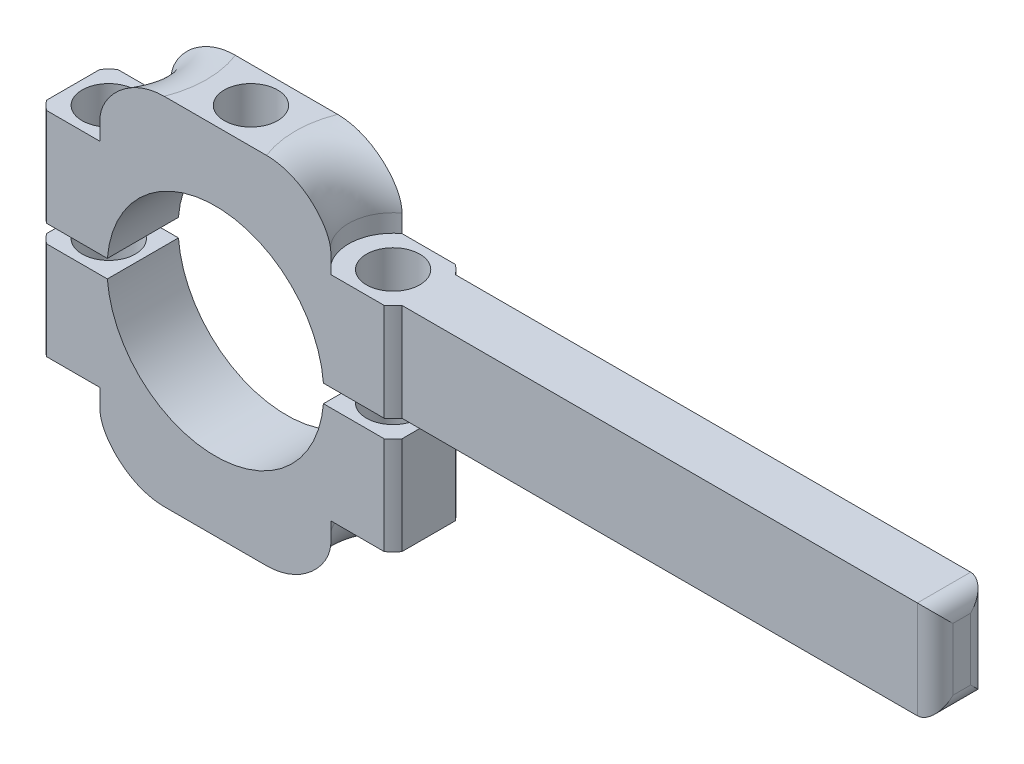
from build123d import *

# Parameters (mm, degrees)
BOSS_EXTRUDE1_DEPTH   = 4
BOSS_EXTRUDE1_2_DEPTH = 4
CUT_EXTRUDE1_START    = -10
SKETCH2_R             = 2.5
SKETCH2_R_2           = 1.5
CUT_EXTRUDE1_DEPTH    = 4
CUT_EXTRUDE2_START    = 6
SKETCH3_R             = 2.5
SKETCH3_R_2           = 1.5
CUT_EXTRUDE2_DEPTH    = 4
SKETCH4_R             = 1.5
CUT_EXTRUDE3_DEPTH    = 23.715633383
SKETCH5_R             = 1.5
CUT_EXTRUDE4_DEPTH    = 6
FILLET1_R             = 3
FILLET2_R             = 3
SKETCH6_W             = 3
SKETCH6_H             = 5.5
BOSS_EXTRUDE2_DEPTH   = 30
FILLET3_R             = 1


with BuildPart() as part:
    # Sketch1 → Boss-Extrude1 (new body)
    with BuildSketch(Plane.XY):
        with BuildLine():
            Line((-10, -0.5), (-10, -10))
            Line((-10, -10), (10, -10))
            Line((10, -10), (10, -0.5))
            Line((10, -0.5), (6.079473661, -0.5))
            ThreePointArc((6.079473661, -0.5), (0, -6.1), (-6.079473661, -0.5))
            Line((-6.079473661, -0.5), (-10, -0.5))
        make_face()
    extrude(amount=BOSS_EXTRUDE1_DEPTH)

    # Sketch2 → Cut-Extrude1 (cut)
    # profile 1 of 2: a face of its own
    with BuildSketch(Plane(origin=(0, 0, 0), x_dir=(1, 0, 0), z_dir=(0, 1, 0)).offset(CUT_EXTRUDE1_START)):
        with Locations((8, -2)):
            Circle(SKETCH2_R)
    # profile 2 of 2: a face of its own
    with BuildSketch(Plane(origin=(0, 0, 0), x_dir=(1, 0, 0), z_dir=(0, 1, 0)).offset(CUT_EXTRUDE1_START)):
        with Locations((-8, -2)):
            Circle(SKETCH2_R)
        with Locations(Location((-8, -2, 0), (0, 0, 270))):
            Circle(SKETCH2_R_2, mode=Mode.SUBTRACT)
    extrude(amount=CUT_EXTRUDE1_DEPTH, mode=Mode.SUBTRACT)


with BuildPart() as body_2:
    # Sketch1 → Boss-Extrude1 2 (new body)
    with BuildSketch(Plane.XY):
        with BuildLine():
            Line((-10, 10), (-10, 0.5))
            Line((-10, 0.5), (-6.079473661, 0.5))
            ThreePointArc((-6.079473661, 0.5), (0, 6.1), (6.079473661, 0.5))
            Line((6.079473661, 0.5), (10, 0.5))
            Line((10, 0.5), (10, 10))
            Line((10, 10), (-10, 10))
        make_face()
    extrude(amount=BOSS_EXTRUDE1_2_DEPTH)

    # Sketch3 → Cut-Extrude2 (cut)
    # profile 1 of 2: a face of its own
    with BuildSketch(Plane(origin=(0, 0, 0), x_dir=(1, 0, 0), z_dir=(0, 1, 0)).offset(CUT_EXTRUDE2_START)):
        with Locations((-8, -2)):
            Circle(SKETCH3_R)
        with Locations(Location((-8, -2, 0), (0, 0, 270))):
            Circle(SKETCH3_R_2, mode=Mode.SUBTRACT)
    # profile 2 of 2: a face of its own
    with BuildSketch(Plane(origin=(0, 0, 0), x_dir=(1, 0, 0), z_dir=(0, 1, 0)).offset(CUT_EXTRUDE2_START)):
        with Locations((8, -2)):
            Circle(SKETCH3_R)
        with Locations(Location((8, -2, 0), (0, 0, 270))):
            Circle(SKETCH3_R_2, mode=Mode.SUBTRACT)
    extrude(amount=CUT_EXTRUDE2_DEPTH, mode=Mode.SUBTRACT)


with BuildPart() as cut_extrude3_tool:
    # Sketch4 → Cut-Extrude3 (new, through all)
    with BuildSketch(Plane(origin=(0, 10, 0), x_dir=(1, 0, 0), z_dir=(0, 1, 0))):
        with Locations(Location((8, -2, 0), (0, 0, 270))):
            Circle(SKETCH4_R)
        with Locations(Location((-8, -2, 0), (0, 0, 270))):
            Circle(SKETCH4_R)
        with BuildLine():
            Line((-10, -3.5), (-10, -4))
            Line((-10, -4), (-9.5, -4))
            ThreePointArc((-9.5, -4), (-9.767766953, -3.767766953), (-10, -3.5))
        make_face()
        with BuildLine():
            Line((-9.5, 0), (-10, 0))
            Line((-10, 0), (-10, -0.5))
            ThreePointArc((-10, -0.5), (-9.767766953, -0.232233047), (-9.5, 0))
        make_face()
        with BuildLine():
            Line((10, -0.5), (10, 0))
            Line((10, 0), (9.5, 0))
            ThreePointArc((9.5, 0), (9.767766953, -0.232233047), (10, -0.5))
        make_face()
        with BuildLine():
            Line((9.5, -4), (10, -4))
            Line((10, -4), (10, -3.5))
            ThreePointArc((10, -3.5), (9.767766953, -3.767766953), (9.5, -4))
        make_face()
    extrude(amount=-CUT_EXTRUDE3_DEPTH)


with BuildPart() as part_1:
    add(part.part)

    # Cut-Extrude3: cut by cut_extrude3_tool
    add(cut_extrude3_tool.part, mode=Mode.SUBTRACT)

    # Fillet2
    fillet2_edges = [part_1.edges().sort_by_distance(p)[0] for p in [
        (-5.5, -10, 2),
        (5.5, -10, 2),
    ]]
    fillet(fillet2_edges, radius=FILLET2_R)


with BuildPart() as body_2_1:
    add(body_2.part)

    # Cut-Extrude3: cut by cut_extrude3_tool
    add(cut_extrude3_tool.part, mode=Mode.SUBTRACT)

    # Sketch5 → Cut-Extrude4 (cut)
    with BuildSketch(Plane(origin=(0, 10, 0), x_dir=(1, 0, 0), z_dir=(0, 1, 0))):
        with Locations(Location((0, -2, 0), (0, 0, 270))):
            Circle(SKETCH5_R)
    extrude(amount=-CUT_EXTRUDE4_DEPTH, mode=Mode.SUBTRACT)

    # Fillet1
    fillet1_edges = [body_2_1.edges().sort_by_distance(p)[0] for p in [
        (-5.5, 10, 2),
        (5.5, 10, 2),
    ]]
    fillet(fillet1_edges, radius=FILLET1_R)

    # Sketch6 → Boss-Extrude2 (add)
    with BuildSketch(Plane(origin=(10, 0, 0), x_dir=(0, 0, -1), z_dir=(1, 0, 0))):
        with Locations((-2, 3.25)):
            Rectangle(SKETCH6_W, SKETCH6_H)
    extrude(amount=BOSS_EXTRUDE2_DEPTH)

    # Fillet3
    fillet3_edges = [body_2_1.edges().sort_by_distance(p)[0] for p in [
        (40, 3.25, 3.5),
        (40, 0.5, 2),
        (40, 3.25, 0.5),
        (40, 6, 2),
    ]]
    fillet(fillet3_edges, radius=FILLET3_R)


solid = Compound([part_1.part, body_2_1.part])
